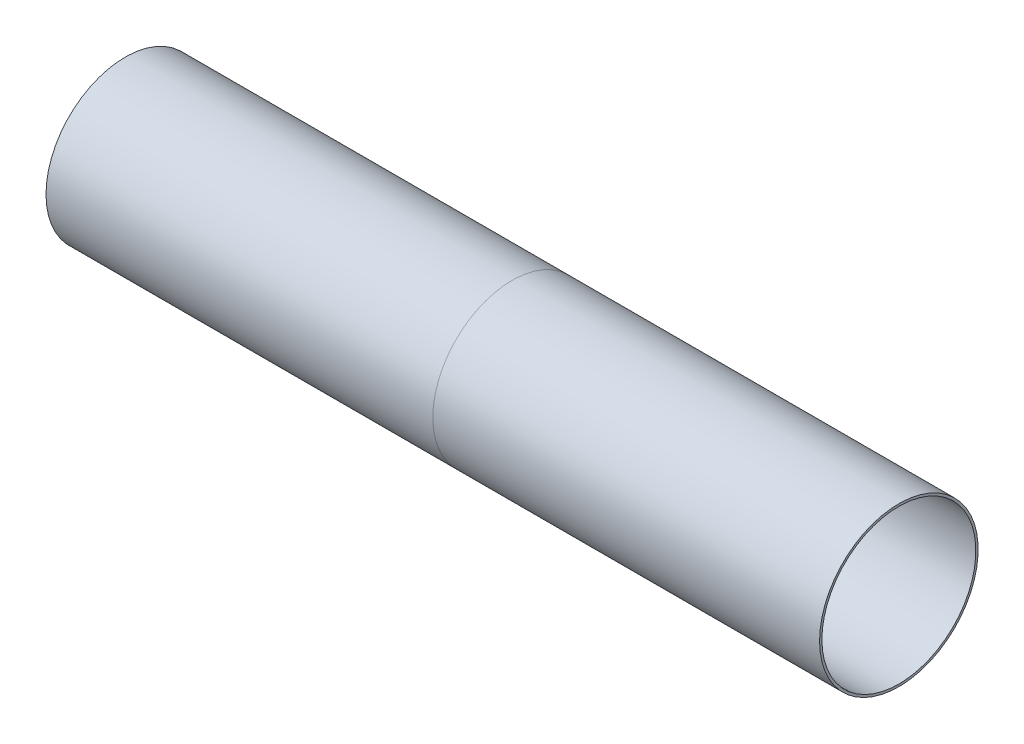
from build123d import *


with BuildPart() as part:
    # Sketch2 → Revolve1 (revolve)
    with BuildSketch(Plane(origin=(0, 0, 0), x_dir=(1, 0, 0), z_dir=(0, 1, 0))):
        Polygon((200, 39.8), (200, 41), (0, 41), (0, 39.8), (11.430052303, 38.8), (12.430052303, 39.8), align=None)
    revolve(axis=Axis((0, 0, 0), (1, 0, 0)))


with BuildPart() as body_2:
    # Sketch2<3> → Revolve2 (revolve)
    with BuildSketch(Plane(origin=(0, 0, 0), x_dir=(1, 0, 0), z_dir=(0, 1, 0))):
        Polygon((0, 39.8), (0, 41), (-200, 41), (-200, 39.8), (-188.569947697, 38.8), (-187.569947697, 39.8), (-12.430052303, 39.8), (-11.430052303, 38.8), align=None)
    revolve(axis=Axis((0, 0, 0), (1, 0, 0)))


with BuildPart() as body_3:
    # Sketch3 → Revolve3 (revolve)
    with BuildSketch(Plane(origin=(0, 0, 0), x_dir=(1, 0, 0), z_dir=(0, 1, 0))):
        Polygon((-11.430052303, 38.8), (0, 39.8), (11.430052303, 38.8), (11.430052303, 37.6), (-11.430052303, 37.6), align=None)
    revolve(axis=Axis((0, 0, 0), (1, 0, 0)))


solid = Compound([part.part, body_2.part, body_3.part])
